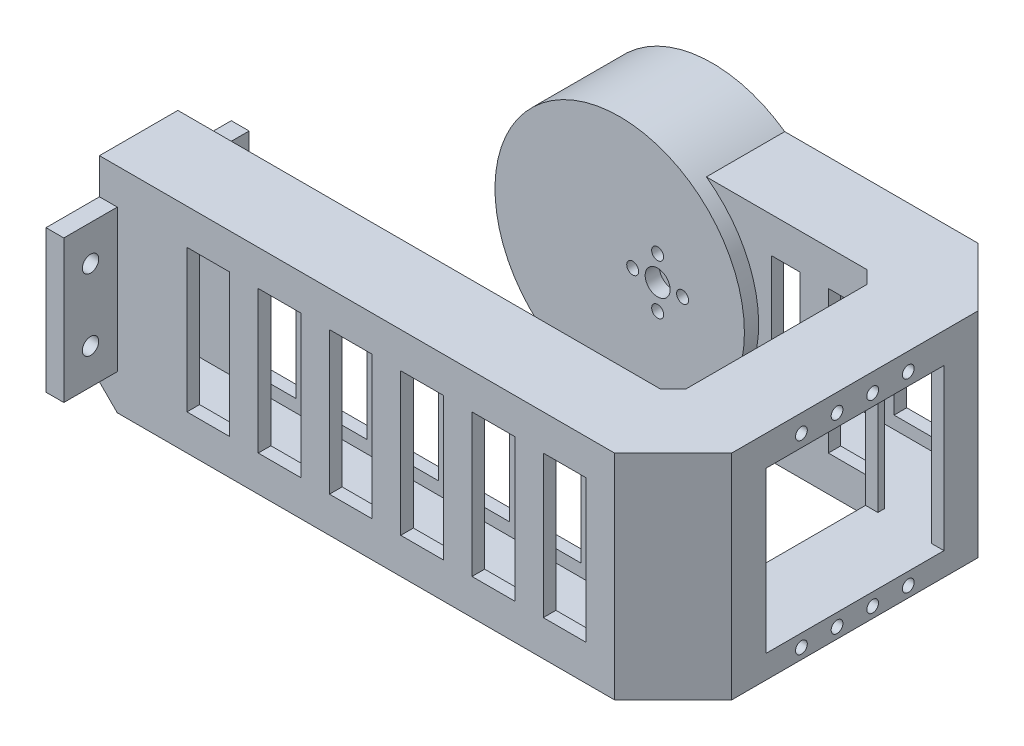
from build123d import *

# Parameters (mm, degrees)
ESQUISSE1_R              = 35
BOSS_EXTRU_2_DEPTH       = 26
ENL_V_MAT_EXTRU_6_DEPTH  = 35
ESQUISSE5_W              = 22
ESQUISSE5_H              = 60
ESQUISSE5_W_2            = 15
ESQUISSE5_H_2            = 45
ESQUISSE7_W              = 22
ESQUISSE7_H              = 60
ESQUISSE7_W_2            = 15
ESQUISSE7_H_2            = 45
ENL_V_MAT_EXTRU_11_DEPTH = 11
ESQUISSE9_R              = 31.5
ENL_V_MAT_EXTRU_12_DEPTH = 18.8
ESQUISSE10_R             = 3.5
ESQUISSE10_R_2           = 1.675
ENL_V_MAT_EXTRU_13_DEPTH = 10
ESQUISSE12_R             = 1.65
ESQUISSE12_W             = 50
ESQUISSE12_H             = 45
ENL_V_MAT_EXTRU_16_DEPTH = 100
ESQUISSE14_W             = 12
ESQUISSE14_H             = 40
ESQUISSE14_W_2           = 8
ENL_V_MAT_EXTRU_17_DEPTH = 40
CHANFREIN1_SIZE          = 5
ESQUISSE18_W             = 12
ESQUISSE18_H             = 40
ENL_V_MAT_EXTRU_19_DEPTH = 25
ESQUISSE19_W             = 5
ESQUISSE19_H             = 40
BOSS_EXTRU_3_DEPTH       = 15
ESQUISSE20_W             = 5
ESQUISSE20_H             = 40
BOSS_EXTRU_4_DEPTH       = 15
ESQUISSE21_R             = 2.3
ENL_V_MAT_EXTRU_20_DEPTH = 15
ESQUISSE22_W             = 10
ESQUISSE22_H             = 40
ENL_V_MAT_EXTRU_21_DEPTH = 10


with BuildPart() as part:
    # Esquisse1 → Boss.-Extru.2 (new body)
    with BuildSketch(Plane.XY):
        with Locations(Location((0, 0, 0), (0, 0, 180))):
            Circle(ESQUISSE1_R)
    extrude(amount=BOSS_EXTRU_2_DEPTH)

    # Esquisse4 → Enlèv. mat.-Extru.6 (cut)
    with BuildSketch(Plane(origin=(0, 0, 0), x_dir=(0, 0, -1), z_dir=(1, 0, 0))):
        with BuildLine():
            Line((-18.5, 16.618380291), (-18.5, -18.381619709))
            ThreePointArc((-18.5, -18.381619709), (-11, -20.763239418), (-3.5, -18.381619709))
            Line((-3.5, -18.381619709), (-3.5, 16.618380291))
            ThreePointArc((-3.5, 16.618380291), (-11, 19), (-18.5, 16.618380291))
        make_face()
    extrude(amount=ENL_V_MAT_EXTRU_6_DEPTH, mode=Mode.SUBTRACT)

    # Balayage16: sweep along a curve in space
    with BuildLine() as balayage16_path:
        Line((0, -1.5, 11), (70, -1.5, 11))
        Line((70, -1.5, 11), (80, -1.5, 21))
        Line((80, -1.5, 21), (80, -1.5, 81))
        Line((80, -1.5, 81), (70, -1.5, 91))
        Line((70, -1.5, 91), (-70, -1.5, 91))
    # Esquisse5 → Balayage16 (sweep)
    with BuildSketch(Plane(origin=(0, 0, 0), x_dir=(0, 0, -1), z_dir=(1, 0, 0))):
        with Locations((-11, -1.5)):
            Rectangle(ESQUISSE5_W, ESQUISSE5_H)
        with Locations((-11.05, -2.5)):
            Rectangle(ESQUISSE5_W_2, ESQUISSE5_H_2, mode=Mode.SUBTRACT)
    sweep(path=balayage16_path.line, transition=Transition.RIGHT)

    # Esquisse7 → Enlèv. mat.-Extru.11 (cut)
    with BuildSketch(Plane(origin=(0, 0, 0), x_dir=(0, 0, -1), z_dir=(1, 0, 0))):
        with Locations((-11, 0)):
            Rectangle(ESQUISSE7_W, ESQUISSE7_H)
        with Locations((-11.5, -2.5)):
            Rectangle(ESQUISSE7_W_2, ESQUISSE7_H_2, mode=Mode.SUBTRACT)
    extrude(amount=ENL_V_MAT_EXTRU_11_DEPTH, mode=Mode.SUBTRACT)

    # Esquisse9 → Enlèv. mat.-Extru.12 (cut)
    with BuildSketch(Plane(origin=(0, 0, 0), x_dir=(-1, 0, 0), z_dir=(0, 0, -1))):
        Circle(ESQUISSE9_R)
    extrude(amount=-ENL_V_MAT_EXTRU_12_DEPTH, mode=Mode.SUBTRACT)

    # Esquisse10 → Enlèv. mat.-Extru.13 (cut)
    with BuildSketch(Plane.XY.offset(26)):
        with Locations((10.65, 0)):
            Circle(ESQUISSE10_R)
        with Locations((17.65, 0)):
            Circle(ESQUISSE10_R_2)
        with Locations(Location((3.65, 0, 0), (0, 0, 90))):
            Circle(ESQUISSE10_R_2)
        with Locations((10.65, -7)):
            Circle(ESQUISSE10_R_2)
        with Locations((10.65, 7)):
            Circle(ESQUISSE10_R_2)
    extrude(amount=-ENL_V_MAT_EXTRU_13_DEPTH, mode=Mode.SUBTRACT)

    # Esquisse12 → Enlèv. mat.-Extru.16 (cut)
    with BuildSketch(Plane(origin=(0, 0, 0), x_dir=(0, 0, -1), z_dir=(1, 0, 0))):
        with Locations(Location((-66, -28.5, 0), (0, 0, 180))):
            Circle(ESQUISSE12_R)
        with Locations(Location((-36, -28.5, 0), (0, 0, 180))):
            Circle(ESQUISSE12_R)
        with Locations(Location((-46, -28.5, 0), (0, 0, 180))):
            Circle(ESQUISSE12_R)
        with Locations(Location((-56, -28.5, 0), (0, 0, 180))):
            Circle(ESQUISSE12_R)
        with Locations(Location((-66, 23.5, 0), (0, 0, 180))):
            Circle(ESQUISSE12_R)
        with Locations(Location((-56, 23.5, 0), (0, 0, 180))):
            Circle(ESQUISSE12_R)
        with Locations(Location((-46, 23.3, 0), (0, 0, 180))):
            Circle(ESQUISSE12_R)
        with Locations(Location((-36, 23.5, 0), (0, 0, 180))):
            Circle(ESQUISSE12_R)
        with Locations((-51, -2.5)):
            Rectangle(ESQUISSE12_W, ESQUISSE12_H)
    extrude(amount=ENL_V_MAT_EXTRU_16_DEPTH, mode=Mode.SUBTRACT)

    # Esquisse14 → Enlèv. mat.-Extru.17 (cut)
    with BuildSketch(Plane(origin=(0, 0, 0), x_dir=(-1, 0, 0), z_dir=(0, 0, -1))):
        with Locations((-60.556349186, -1.5)):
            Rectangle(ESQUISSE14_W, ESQUISSE14_H)
        with Locations((-42.556349186, -1.5)):
            Rectangle(ESQUISSE14_W_2, ESQUISSE14_H)
    extrude(amount=-ENL_V_MAT_EXTRU_17_DEPTH, mode=Mode.SUBTRACT)

    # Chanfrein1
    chanfrein1_edges = [part.edges().sort_by_distance(p)[0] for p in [
        (-70, -31.5, 91),
    ]]
    chamfer(chanfrein1_edges, length=CHANFREIN1_SIZE)

    # Esquisse18 → Enlèv. mat.-Extru.19 (cut)
    with BuildSketch(Plane.XY.offset(102)):
        with Locations((60.556349186, -1.5)):
            Rectangle(ESQUISSE18_W, ESQUISSE18_H)
        with Locations((-19.443650814, -1.5)):
            Rectangle(ESQUISSE18_W, ESQUISSE18_H)
        with Locations((40.556349186, -1.5)):
            Rectangle(ESQUISSE18_W, ESQUISSE18_H)
        with Locations((20.556349186, -1.5)):
            Rectangle(ESQUISSE18_W, ESQUISSE18_H)
        with Locations((0.556349186, -1.5)):
            Rectangle(ESQUISSE18_W, ESQUISSE18_H)
        with Locations((-39.443650814, -1.5)):
            Rectangle(ESQUISSE18_W, ESQUISSE18_H)
    extrude(amount=-ENL_V_MAT_EXTRU_19_DEPTH, mode=Mode.SUBTRACT)

    # Esquisse19 → Boss.-Extru.3 (add)
    with BuildSketch(Plane.XY.offset(102)):
        with Locations((-67.5, -1.5)):
            Rectangle(ESQUISSE19_W, ESQUISSE19_H)
    extrude(amount=BOSS_EXTRU_3_DEPTH)

    # Esquisse20 → Boss.-Extru.4 (add)
    with BuildSketch(Plane(origin=(0, 0, 80), x_dir=(-1, 0, 0), z_dir=(0, 0, -1))):
        with Locations((67.5, -1.5)):
            Rectangle(ESQUISSE20_W, ESQUISSE20_H)
    extrude(amount=BOSS_EXTRU_4_DEPTH)

    # Esquisse21 → Enlèv. mat.-Extru.20 (cut)
    with BuildSketch(Plane(origin=(-65, 0, 0), x_dir=(0, 0, -1), z_dir=(1, 0, 0))):
        with Locations(Location((-109.5, 8.5, 0), (0, 0, 90))):
            Circle(ESQUISSE21_R)
        with Locations(Location((-109.5, -11.5, 0), (0, 0, 90))):
            Circle(ESQUISSE21_R)
        with Locations(Location((-72.5, 8.5, 0), (0, 0, 90))):
            Circle(ESQUISSE21_R)
        with Locations(Location((-72.5, -11.5, 0), (0, 0, 90))):
            Circle(ESQUISSE21_R)
    extrude(amount=-ENL_V_MAT_EXTRU_20_DEPTH, mode=Mode.SUBTRACT)

    # Esquisse22 → Enlèv. mat.-Extru.21 (cut)
    with BuildSketch(Plane(origin=(37.278174593, 0, -37.278174593), x_dir=(-0.7071067811865475, 0, -0.7071067811865476), z_dir=(0.7071067811865476, 0, -0.7071067811865475))):
        with Locations((-64.71930009, -1.5)):
            Rectangle(ESQUISSE22_W, ESQUISSE22_H)
    extrude(amount=-ENL_V_MAT_EXTRU_21_DEPTH, mode=Mode.SUBTRACT)


solid = part.part
